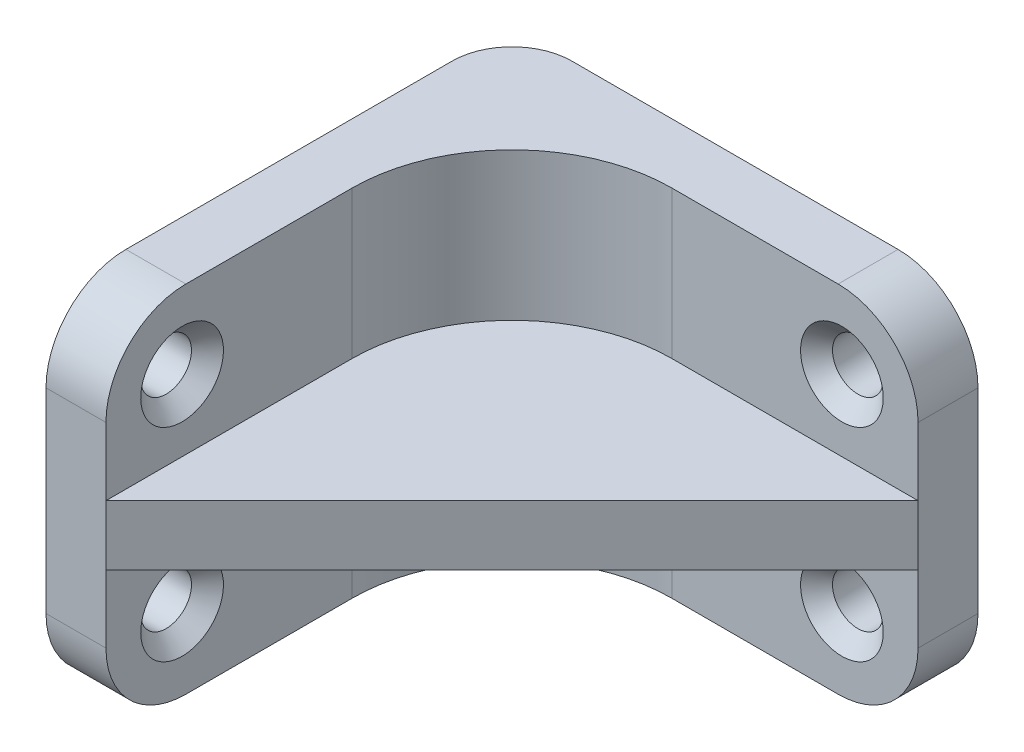
from build123d import *

# Parameters (mm, degrees)
SKETCH1_R           = 3.175
BOSS_EXTRUDE1_DEPTH = 7.5
SKETCH2_R           = 3.175
BOSS_EXTRUDE2_DEPTH = 7.5
BOSS_EXTRUDE3_DEPTH = 44.45
FILLET1_R           = 20
BOSS_EXTRUDE4_DEPTH = 3.75
CHAMFER1_SIZE       = 2


with BuildPart() as part:
    # Sketch1 → Boss-Extrude1 (new body)
    with BuildSketch(Plane.XY):
        with BuildLine():
            Line((-41.275, 9.525), (-0.475, 9.525))
            ThreePointArc((-0.475, 9.525), (6.596067812, 6.596067812), (9.525, -0.475))
            Line((9.525, -0.475), (9.525, -24.925))
            ThreePointArc((9.525, -24.925), (6.596067812, -31.996067812), (-0.475, -34.925))
            Line((-0.475, -34.925), (-41.275, -34.925))
            Line((-41.275, -34.925), (-41.275, 9.525))
        make_face()
        Circle(SKETCH1_R, mode=Mode.SUBTRACT)
        with Locations(Location((0, -25.4, 0), (0, 0, 180))):
            Circle(SKETCH1_R, mode=Mode.SUBTRACT)
    extrude(amount=BOSS_EXTRUDE1_DEPTH)



with BuildPart() as body_2:
    # Sketch2 → Boss-Extrude2 (new body)
    with BuildSketch(Plane.ZY.offset(41.275)):
        with BuildLine():
            Line((7.5, 9.525), (48.3, 9.525))
            ThreePointArc((48.3, 9.525), (55.371067812, 6.596067812), (58.3, -0.475))
            Line((58.3, -0.475), (58.3, -24.925))
            ThreePointArc((58.3, -24.925), (55.371067812, -31.996067812), (48.3, -34.925))
            Line((48.3, -34.925), (7.5, -34.925))
            Line((7.5, -34.925), (7.5, 9.525))
        make_face()
        with Locations(Location((48.775, 0, 0), (0, 0, 270))):
            Circle(SKETCH2_R, mode=Mode.SUBTRACT)
        with Locations(Location((48.775, -25.4, 0), (0, 0, 90))):
            Circle(SKETCH2_R, mode=Mode.SUBTRACT)
    extrude(amount=BOSS_EXTRUDE2_DEPTH)


with BuildPart() as part_1:
    add(part.part)

    add(body_2.part)  # Boss-Extrude3 merges body 2
    # Sketch3 → Boss-Extrude3 (add)
    with BuildSketch(Plane.XZ.offset(34.925)):
        with BuildLine():
            Line((-48.775, 7.5), (-41.275, 7.5))
            Line((-41.275, 7.5), (-41.275, 0))
            ThreePointArc((-41.275, 0), (-46.578300859, 2.196699141), (-48.775, 7.5))
        make_face()
    extrude(amount=-BOSS_EXTRUDE3_DEPTH)

    # Fillet1
    fillet1_edges = [part_1.edges().sort_by_distance(p)[0] for p in [
        (-41.275, -12.7, 7.5),
    ]]
    fillet(fillet1_edges, radius=FILLET1_R)

    # Sketch4 → Boss-Extrude4 (add, symmetric)
    with BuildSketch(Plane(origin=(0, -12.7, 0), x_dir=(1, 0, 0), z_dir=(0, 1, 0))):
        with BuildLine():
            Line((-0.475, -7.5), (9.525, -7.5))
            Line((9.525, -7.5), (-41.275, -58.3))
            Line((-41.275, -58.3), (-41.275, -48.3))
            Line((-41.275, -48.3), (-41.275, -27.5))
            ThreePointArc((-41.275, -27.5), (-35.417135624, -13.357864376), (-21.275, -7.5))
            Line((-21.275, -7.5), (-0.475, -7.5))
        make_face()
    extrude(amount=BOSS_EXTRUDE4_DEPTH, both=True)

    # Chamfer1
    chamfer1_edges = [part_1.edges().sort_by_distance(p)[0] for p in [
        (-3.175, 0, 7.5),
        (3.175, -25.4, 7.5),
        (-41.275, 3.175, 48.775),
        (-41.275, -28.575, 48.775),
    ]]
    chamfer(chamfer1_edges, length=CHAMFER1_SIZE)


solid = part_1.part
